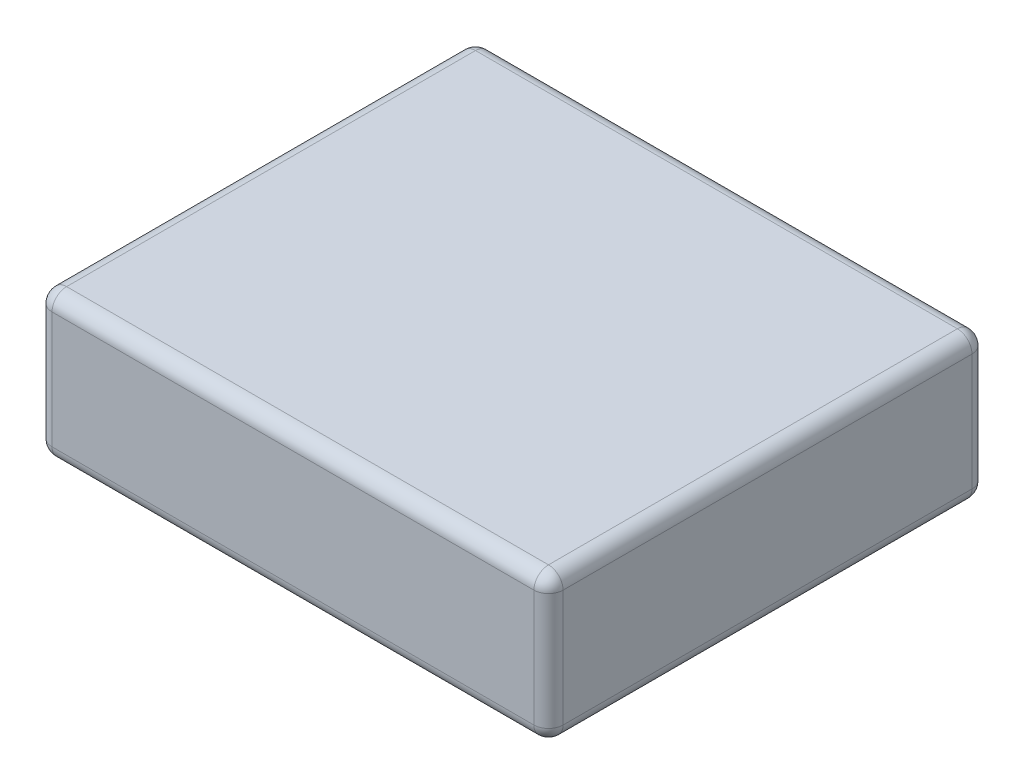
from build123d import *

# Parameters (mm, degrees)
SKETCH1_W           = 70
SKETCH1_H           = 20
BOSS_EXTRUDE1_DEPTH = 60
FILLET1_R           = 2


with BuildPart() as part:
    # Sketch1 → Boss-Extrude1 (new body)
    with BuildSketch(Plane.XY):
        with Locations((1.644295302, -5.151006711)):
            Rectangle(SKETCH1_W, SKETCH1_H)
    extrude(amount=BOSS_EXTRUDE1_DEPTH)

    # Fillet1
    fillet1_edges = [part.edges().sort_by_distance(p)[0] for p in [
        (-33.355704698, -5.151006711, 60),
        (1.644295302, -15.151006711, 60),
        (36.644295302, -5.151006711, 60),
        (1.644295302, -15.151006711, 0),
        (-33.355704698, -5.151006711, 0),
        (1.644295302, 4.848993289, 0),
        (36.644295302, -5.151006711, 0),
        (36.644295302, -15.151006711, 30),
        (-33.355704698, -15.151006711, 30),
        (-33.355704698, 4.848993289, 30),
        (36.644295302, 4.848993289, 30),
        (1.644295302, 4.848993289, 60),
    ]]
    fillet(fillet1_edges, radius=FILLET1_R)


solid = part.part
